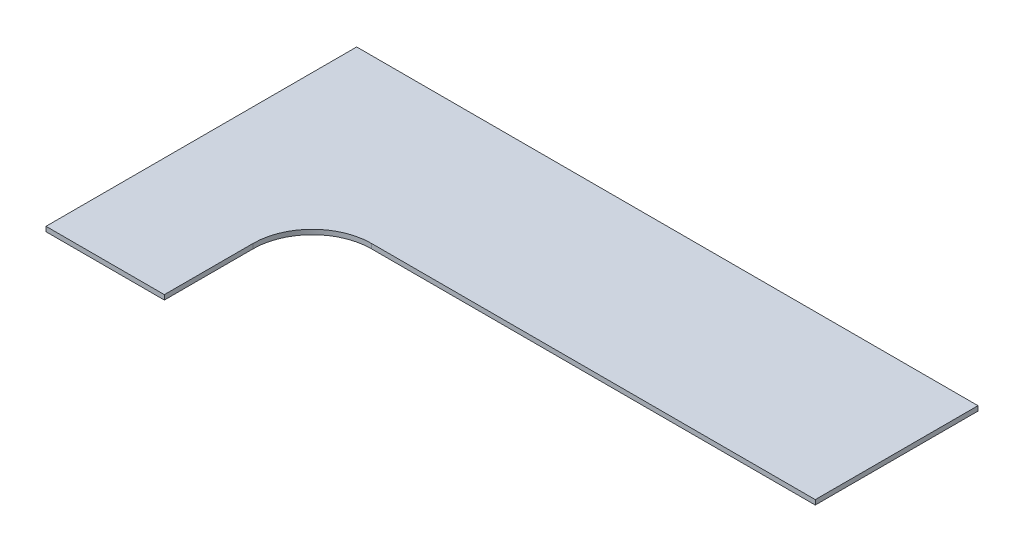
from build123d import *

# Parameters (mm, degrees)
AUFSATZ_LINEAR_AUSTRAGEN1_DEPTH = 16


with BuildPart() as part:
    # Skizze1 → Aufsatz-Linear austragen1 (new body)
    with BuildSketch(Plane(origin=(0, 0, 0), x_dir=(1, 0, 0), z_dir=(0, 1, 0))):
        with BuildLine():
            Line((0, 0), (2100, 0))
            Line((2100, 0), (2100, -550))
            Line((2100, -550), (600, -550))
            ThreePointArc((600, -550), (458.578643763, -608.578643763), (400, -750))
            Line((400, -750), (400, -1050))
            Line((400, -1050), (0, -1050))
            Line((0, -1050), (0, 0))
        make_face()
    extrude(amount=AUFSATZ_LINEAR_AUSTRAGEN1_DEPTH)


solid = part.part
